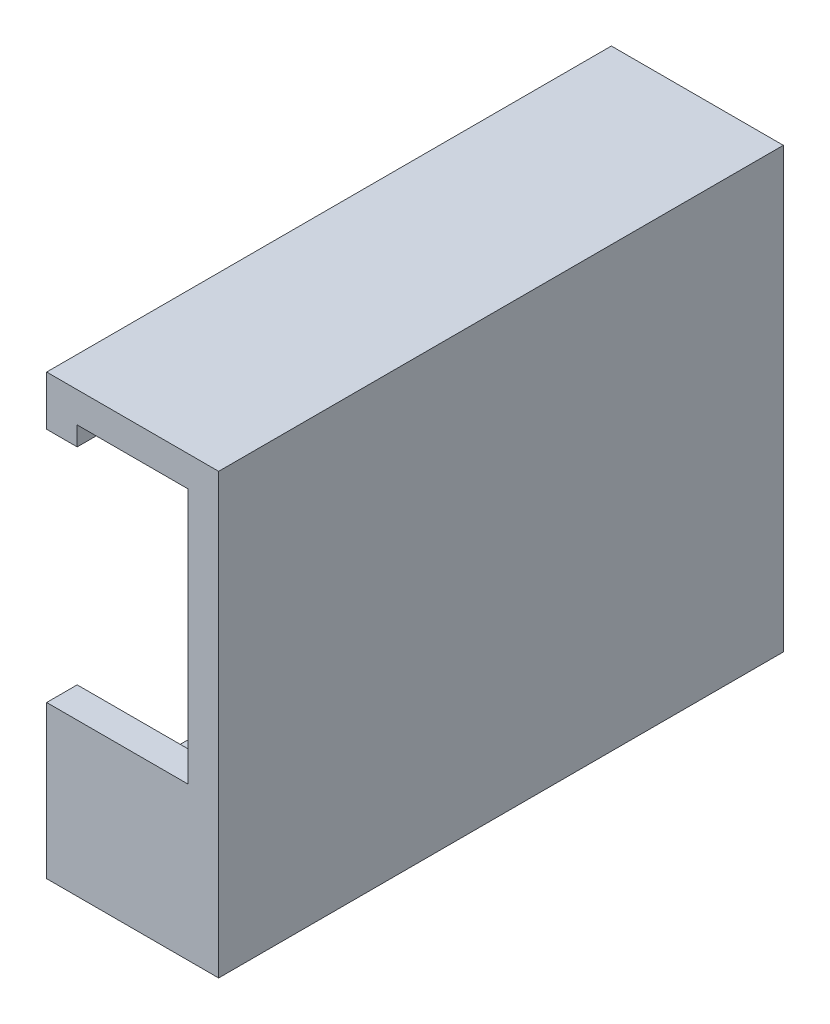
from build123d import *

# Parameters (mm, degrees)
EXTRUDE_THIN1_DEPTH = 93.98
SKETCH2_W           = 28.622498
SKETCH2_H           = 25.4
BOSS_EXTRUDE1_DEPTH = 5.08


with BuildPart() as part:
    # Sketch1 → Extrude-Thin1 (new body)
    with BuildSketch(Plane.XY):
        Polygon((-18.462498, 59.69), (-18.462498, 62.865), (0, 62.865), (0, 0), (-18.462498, 0), (-18.462498, 3.175), (-23.542498, 3.175), (-23.542498, -5.08), (5.08, -5.08), (5.08, 67.945), (-23.542498, 67.945), (-23.542498, 59.69), align=None)
    extrude(amount=EXTRUDE_THIN1_DEPTH)

    # Sketch2 → Boss-Extrude1 (add)
    with BuildSketch(Plane.XY.offset(93.98)):
        with Locations((-9.231249, 7.62)):
            Rectangle(SKETCH2_W, SKETCH2_H)
    extrude(amount=-BOSS_EXTRUDE1_DEPTH)


solid = part.part
